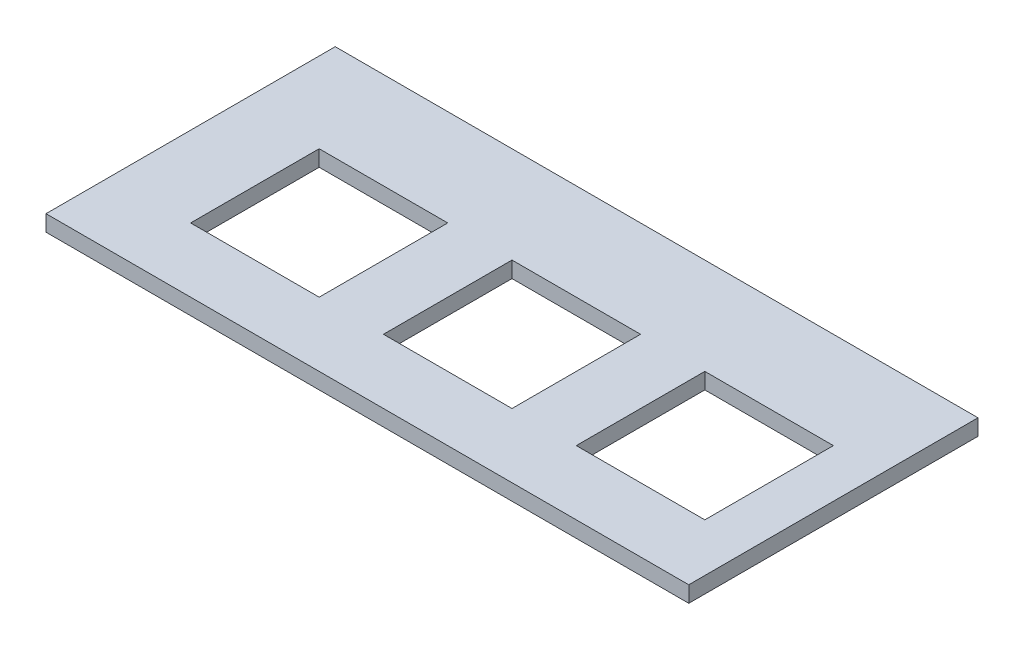
from build123d import *

# Parameters (mm, degrees)
ESQUISSE1_W             = 400
ESQUISSE1_H             = 180
BOSS_EXTRU_1_DEPTH      = 10
ESQUISSE2_W             = 80
ESQUISSE2_H             = 80
ENL_V_MAT_EXTRU_1_DEPTH = 10


with BuildPart() as part:
    # Esquisse1 → Boss.-Extru.1 (new body)
    with BuildSketch(Plane(origin=(0, 0, 0), x_dir=(1, 0, 0), z_dir=(0, 1, 0))):
        with Locations((-200, 90)):
            Rectangle(ESQUISSE1_W, ESQUISSE1_H)
    extrude(amount=BOSS_EXTRU_1_DEPTH)

    # Esquisse2 → Enlèv. mat.-Extru.1 (cut)
    with BuildSketch(Plane(origin=(0, 10, 0), x_dir=(1, 0, 0), z_dir=(0, 1, 0))):
        with Locations((-310, 80)):
            Rectangle(ESQUISSE2_W, ESQUISSE2_H)
        with Locations((-190, 80)):
            Rectangle(ESQUISSE2_W, ESQUISSE2_H)
        with Locations((-70, 80)):
            Rectangle(ESQUISSE2_W, ESQUISSE2_H)
    extrude(amount=-ENL_V_MAT_EXTRU_1_DEPTH, mode=Mode.SUBTRACT)


solid = part.part
